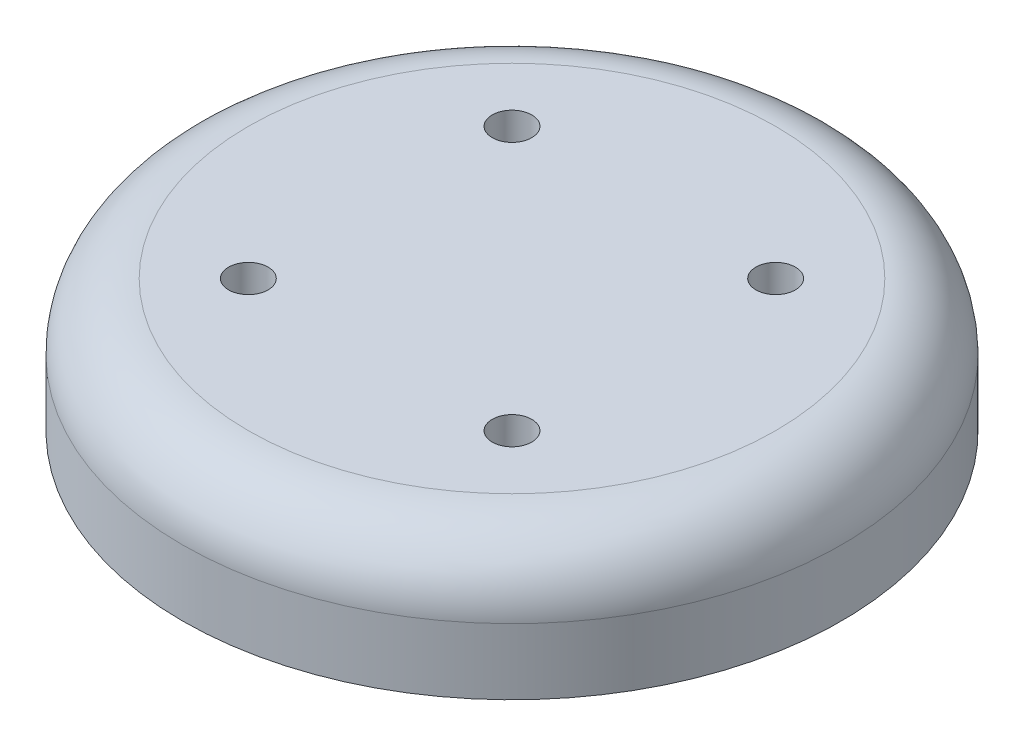
from build123d import *

# Parameters (mm, degrees)
SKETCH1_R           = 25
BOSS_EXTRUDE1_DEPTH = 10
FILLET1_R           = 5
SKETCH2_R           = 1.5
CUT_EXTRUDE1_DEPTH  = 37.74234621
SKETCH3_R           = 20
CUT_EXTRUDE2_DEPTH  = 5


with BuildPart() as part:
    # Sketch1 → Boss-Extrude1 (new body)
    with BuildSketch(Plane(origin=(0, 0, 0), x_dir=(1, 0, 0), z_dir=(0, 1, 0))):
        with Locations(Location((0, 0, 0), (0, 0, 270))):
            Circle(SKETCH1_R)
    extrude(amount=BOSS_EXTRUDE1_DEPTH)

    # Fillet1
    fillet1_edges = [part.edges().sort_by_distance(p)[0] for p in [
        (0, 10, -25),
    ]]
    fillet(fillet1_edges, radius=FILLET1_R)

    # Sketch2 → Cut-Extrude1 (cut, through all)
    with BuildSketch(Plane(origin=(0, 10, 0), x_dir=(1, 0, 0), z_dir=(0, 1, 0))):
        with Locations(Location((-10, 10, 0), (0, 0, 270))):
            Circle(SKETCH2_R)
        with Locations(Location((10, 10, 0), (0, 0, 270))):
            Circle(SKETCH2_R)
        with Locations(Location((-10, -10, 0), (0, 0, 270))):
            Circle(SKETCH2_R)
        with Locations(Location((10, -10, 0), (0, 0, 270))):
            Circle(SKETCH2_R)
    extrude(amount=-CUT_EXTRUDE1_DEPTH, mode=Mode.SUBTRACT)

    # Sketch3 → Cut-Extrude2 (cut)
    with BuildSketch(Plane.XZ):
        with Locations(Location((0, 0, 0), (0, 0, 270))):
            Circle(SKETCH3_R)
    extrude(amount=-CUT_EXTRUDE2_DEPTH, mode=Mode.SUBTRACT)


solid = part.part
